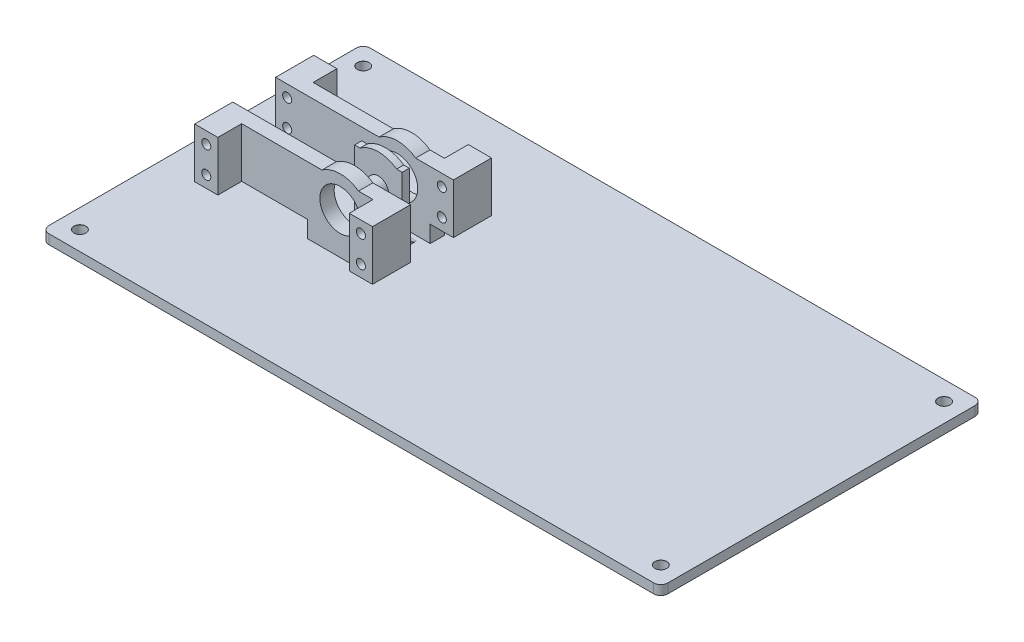
from build123d import *

# Parameters (mm, degrees)
SKETCH_1_W                      = 260
SKETCH_1_H                      = 135
EXTRUDE_1_DEPTH                 = 4
HOLE_WIZARD_5_0_5_1_D           = 5
HOLE_WIZARD_5_0_5_1_CSINK_D     = 5.05
HOLE_WIZARD_5_0_5_1_CSINK_ANGLE = 90
FILLET_1_R                      = 3
EXTRUDE_2_DEPTH                 = 15
SKETCH_5_W                      = 5
SKETCH_5_H                      = 30.479983875
SKETCH_5_W_2                    = 10
CUT_EXTRUDE_2_DEPTH             = 251.053170719
SKETCH_7_W                      = 41.194630643
SKETCH_7_H                      = 3
CUT_EXTRUDE_3_DEPTH             = 20.987549798
SKETCH_8_W                      = 13.542667964
SKETCH_8_H                      = 3
CUT_EXTRUDE_5_DEPTH             = 28.013263597
SKETCH_9_W                      = 3.853145938
SKETCH_9_H                      = 3
CUT_EXTRUDE_6_DEPTH             = 7.025713799
SKETCH_11_W                     = 9.744219549
SKETCH_11_H                     = 20.987549798
EXTRUDE_3_DEPTH                 = 10
SKETCH_12_W                     = 9.744219549
SKETCH_12_H                     = 20.987549798
EXTRUDE_4_DEPTH                 = 10
SKETCH_13_R                     = 1.907696141
CUT_EXTRUDE_7_DEPTH             = 164.233327749
SKETCH_15_R                     = 8.546756312
CUT_EXTRUDE_8_DEPTH             = 10
EXTRUDE_5_DEPTH                 = 5
EXTRUDE_5_DEPTH_BACK            = 5
SKETCH_16_R                     = 4.379825861
FILLET_2_R                      = 3


with BuildPart() as part:
    # 草图1 → 凸台-拉伸1 (new body)
    with BuildSketch(Plane(origin=(0, 0, 0), x_dir=(1, 0, 0), z_dir=(0, 1, 0))):
        Rectangle(SKETCH_1_W, SKETCH_1_H)
    extrude(amount=EXTRUDE_1_DEPTH)

    # Ø5.0 (5) 直径孔1 (through all)
    with Locations(Plane(origin=(0, 4, 0), x_dir=(1, 0, 0), z_dir=(0, 1, 0))):
        with Locations((-122, 59.5), (-122, -59.5), (122, -59.5), (122, 59.5)):
            CounterSinkHole(HOLE_WIZARD_5_0_5_1_D / 2, HOLE_WIZARD_5_0_5_1_CSINK_D / 2, counter_sink_angle=HOLE_WIZARD_5_0_5_1_CSINK_ANGLE)

    # 圆角1
    fillet_1_edges = [part.edges().sort_by_distance(p)[0] for p in [
        (130, 2, 67.5),
        (-130, 2, 67.5),
        (-130, 2, -67.5),
        (130, 2, -67.5),
    ]]
    fillet(fillet_1_edges, radius=FILLET_1_R)

    # 草图4 → 凸台-拉伸2 (add, symmetric)
    with BuildSketch(Plane.XY):
        with BuildLine():
            Line((-70.947140493, 4), (-43.349875336, 4))
            Line((-43.349875336, 4), (-43.349875336, 11.025713799))
            Line((-43.349875336, 11.025713799), (-33.605655787, 11.025713799))
            Line((-33.605655787, 11.025713799), (-33.605655787, 32.013263597))
            Line((-33.605655787, 32.013263597), (-43.349875336, 32.013263597))
            Line((-43.349875336, 32.013263597), (-49.476243699, 32.013263597))
            ThreePointArc((-49.476243699, 32.013263597), (-57.148507914, 34.479983875), (-64.82077213, 32.013263597))
            Line((-64.82077213, 32.013263597), (-98.544405649, 32.013263597))
            Line((-98.544405649, 32.013263597), (-108.288625198, 32.013263597))
            Line((-108.288625198, 32.013263597), (-108.288625198, 11.025713799))
            Line((-108.288625198, 11.025713799), (-98.544405649, 11.025713799))
            Line((-98.544405649, 11.025713799), (-70.947140493, 11.025713799))
            Line((-70.947140493, 11.025713799), (-70.947140493, 4))
        make_face()
    extrude(amount=EXTRUDE_2_DEPTH, both=True)

    # 草图5 → 切除-拉伸2 (cut, through all)
    with BuildSketch(Plane.ZY.offset(108.288625198)):
        with Locations((-6.5, 19.239991938)):
            Rectangle(SKETCH_5_W, SKETCH_5_H)
        with Locations((4, 19.239991938)):
            Rectangle(SKETCH_5_W_2, SKETCH_5_H)
    extrude(amount=-CUT_EXTRUDE_2_DEPTH, mode=Mode.SUBTRACT)

    # 草图7 → 切除-拉伸3 (cut)
    with BuildSketch(Plane(origin=(0, 32.013263597, 0), x_dir=(1, 0, 0), z_dir=(0, 1, 0))):
        with Locations((-87.691309877, 2.5)):
            Rectangle(SKETCH_7_W, SKETCH_7_H)
    extrude(amount=-CUT_EXTRUDE_3_DEPTH, mode=Mode.SUBTRACT)

    # 草图8 → 切除-拉伸5 (cut)
    with BuildSketch(Plane(origin=(0, 32.013263597, 0), x_dir=(1, 0, 0), z_dir=(0, 1, 0))):
        with Locations((-40.376989769, 2.5)):
            Rectangle(SKETCH_8_W, SKETCH_8_H)
    extrude(amount=-CUT_EXTRUDE_5_DEPTH, mode=Mode.SUBTRACT)

    # 草图9 → 切除-拉伸6 (cut)
    with BuildSketch(Plane(origin=(0, 11.025713799, 0), x_dir=(1, 0, 0), z_dir=(0, 1, 0))):
        with Locations((-69.020567524, 2.5)):
            Rectangle(SKETCH_9_W, SKETCH_9_H)
    extrude(amount=-CUT_EXTRUDE_6_DEPTH, mode=Mode.SUBTRACT)

    # 草图11 → 凸台-拉伸3 (add)
    with BuildSketch(Plane.XY.offset(15)):
        with Locations((-38.477765562, 21.519488698)):
            Rectangle(SKETCH_11_W, SKETCH_11_H)
        with Locations((-103.416515424, 21.519488698)):
            Rectangle(SKETCH_11_W, SKETCH_11_H)
    extrude(amount=EXTRUDE_3_DEPTH)

    # 草图12 → 凸台-拉伸4 (add)
    with BuildSketch(Plane(origin=(0, 0, -15), x_dir=(-1, 0, 0), z_dir=(0, 0, -1))):
        with Locations((38.477765562, 21.519488698)):
            Rectangle(SKETCH_12_W, SKETCH_12_H)
        with Locations((103.416515424, 21.519488698)):
            Rectangle(SKETCH_12_W, SKETCH_12_H)
    extrude(amount=EXTRUDE_4_DEPTH)

    # 草图13 → 切除-拉伸7 (cut, through all)
    with BuildSketch(Plane.XY.offset(25)):
        with Locations(Location((-38.477765562, 27.075045448, 0), (0, 0, 90))):
            Circle(SKETCH_13_R)
        with Locations(Location((-38.477765562, 15.963931947, 0), (0, 0, 90))):
            Circle(SKETCH_13_R)
        with Locations((-103.416515423, 15.963931947)):
            Circle(SKETCH_13_R)
        with Locations((-103.416515423, 27.075045448)):
            Circle(SKETCH_13_R)
    extrude(amount=-CUT_EXTRUDE_7_DEPTH, mode=Mode.SUBTRACT)

    # 草图15 → 切除-拉伸8 (cut)
    with BuildSketch(Plane.XY.offset(15)):
        with Locations((-57.148507914, 21.315064512)):
            Circle(SKETCH_15_R)
    cut_extrude_8 = extrude(amount=-CUT_EXTRUDE_8_DEPTH, mode=Mode.SUBTRACT)

    # 镜向3: 切除-拉伸8 across plane
    add(cut_extrude_8.mirror(Plane.XY), mode=Mode.SUBTRACT)

    # 草图16 → 凸台-拉伸5 (add, two sides: drawn at the far end of the back side and taken through both)
    with BuildSketch(Plane.XY.offset(-1).offset(-EXTRUDE_5_DEPTH_BACK)):
        with Locations((-57.148507914, 21.315064512)):
            Circle(SKETCH_16_R)
    extrude(amount=EXTRUDE_5_DEPTH + EXTRUDE_5_DEPTH_BACK)

    # 圆角2
    fillet_2_edges = [part.edges().sort_by_distance(p)[0] for p in [
        (-57.121159153, 4, -4),
        (-57.121159153, 4, -1),
    ]]
    fillet(fillet_2_edges, radius=FILLET_2_R)


solid = part.part
